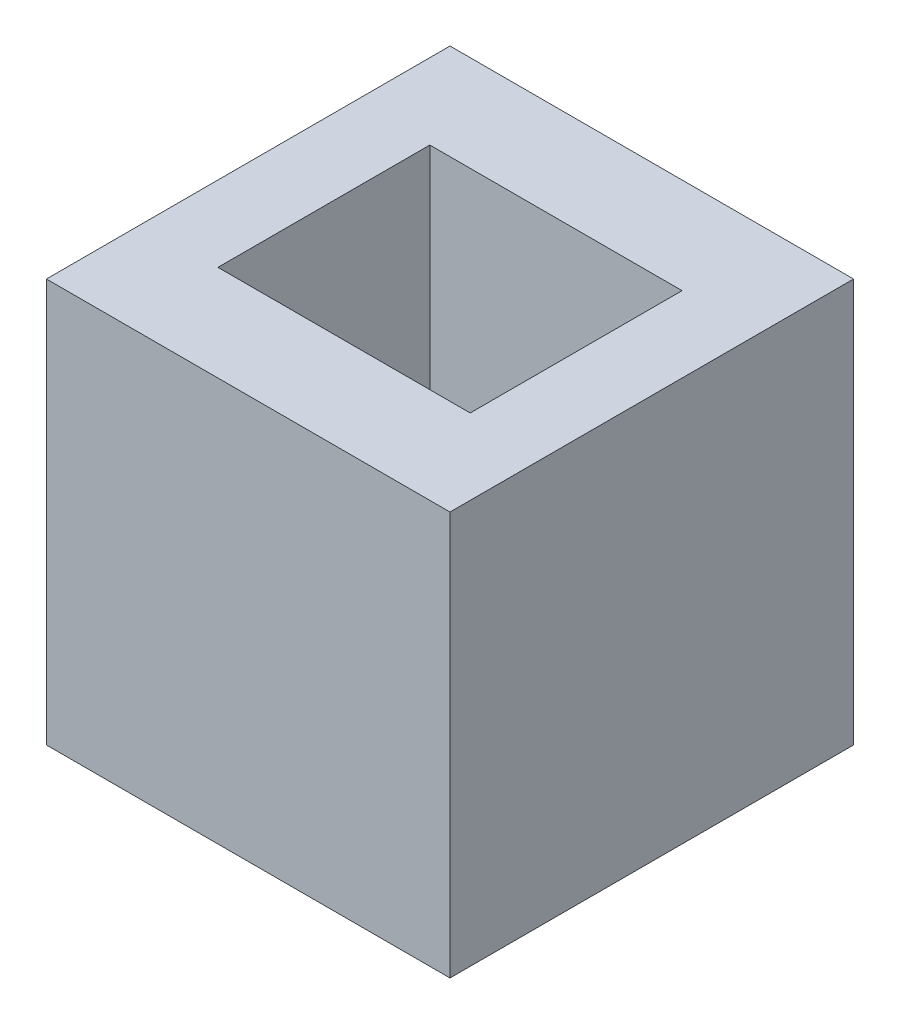
from build123d import *

# Parameters (mm, degrees)
SKETCH1_W           = 20
SKETCH1_H           = 20
SKETCH1_W_2         = 12.5
SKETCH1_H_2         = 10.5
BOSS_EXTRUDE1_DEPTH = 20


with BuildPart() as part:
    # Sketch1 → Boss-Extrude1 (new body)
    with BuildSketch(Plane(origin=(0, 0, 0), x_dir=(1, 0, 0), z_dir=(0, 1, 0))):
        Rectangle(SKETCH1_W, SKETCH1_H)
        Rectangle(SKETCH1_W_2, SKETCH1_H_2, mode=Mode.SUBTRACT)
    extrude(amount=BOSS_EXTRUDE1_DEPTH)


solid = part.part
